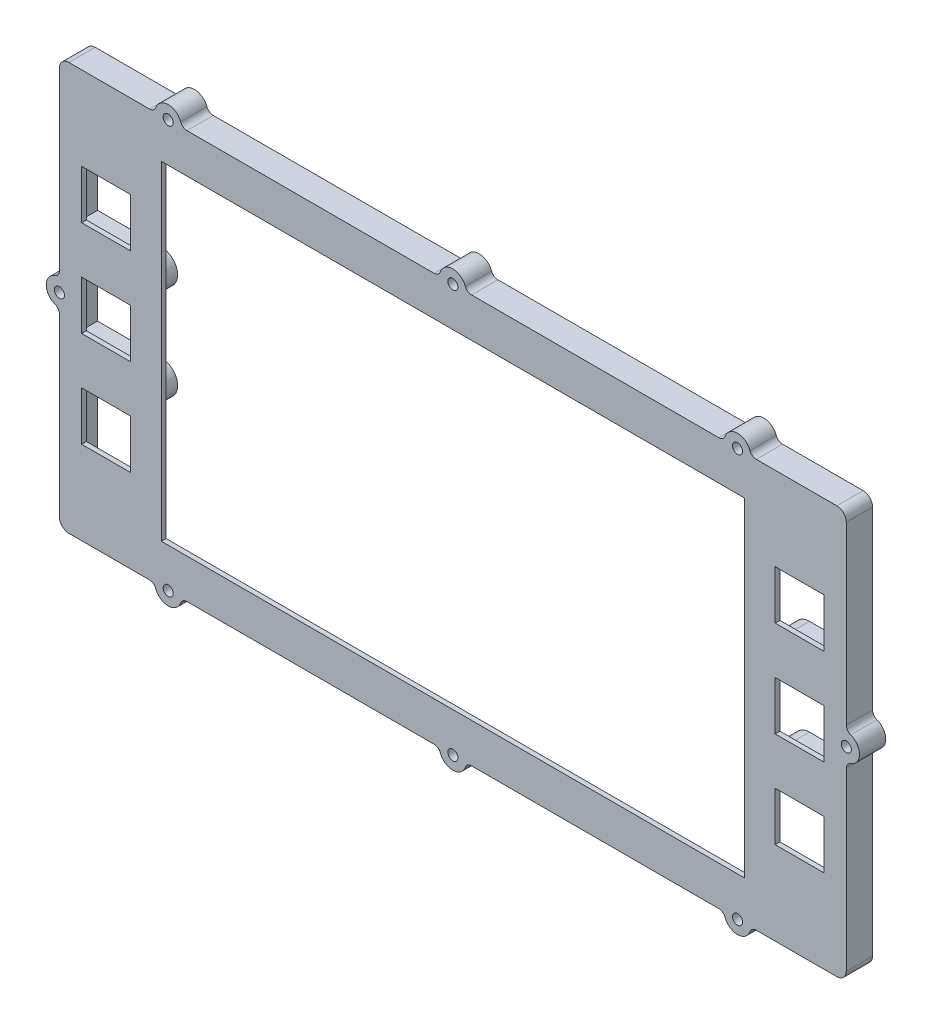
from build123d import *

# Parameters (mm, degrees)
SKETCH1_W           = 210.6422
SKETCH1_H           = 109.1692
BOSS_EXTRUDE1_DEPTH = 5.7658
SKETCH2_W           = 210.6422
SKETCH2_H           = 109.1692
SKETCH2_W_2         = 13.081
SKETCH2_H_2         = 13.081
SKETCH2_W_3         = 156.083
SKETCH2_H_3         = 88.0872
BOSS_EXTRUDE2_DEPTH = 1.27
CUT_EXTRUDE1_REACH  = 120.834
SKETCH3_R           = 1.3462
SKETCH3_3_R         = 1.3462
BOSS_EXTRUDE3_DEPTH = 7.0358
FILLET1_R           = 2.54
CUT_EXTRUDE2_REACH  = 122.497
SKETCH4_R           = 1.3462
SKETCH4_3_R         = 1.3462
BOSS_EXTRUDE4_DEPTH = 7.0358


with BuildPart() as part:
    # Sketch1 → Boss-Extrude1 (new body)
    with BuildSketch(Plane.XY):
        Rectangle(SKETCH1_W, SKETCH1_H)
        with BuildLine():
            Line((45.6565, 49.7078), (45.6565, 51.4096))
            Line((45.6565, 51.4096), (-42.2275, 51.4096))
            Line((-42.2275, 51.4096), (-42.2275, 49.7078))
            ThreePointArc((-42.2275, 49.7078), (-45.4025, 46.5328), (-48.5775, 49.7078))
            Line((-48.5775, 49.7078), (-48.5775, 51.4096))
            Line((-48.5775, 51.4096), (-73.9775, 51.4096))
            Line((-73.9775, 51.4096), (-73.9775, 49.7078))
            ThreePointArc((-73.9775, 49.7078), (-77.1525, 46.5328), (-80.3275, 49.7078))
            Line((-80.3275, 49.7078), (-80.3275, 51.4096))
            Line((-80.3275, 51.4096), (-102.1461, 51.4096))
            Line((-102.1461, 51.4096), (-102.1461, 17.1069))
            Line((-102.1461, 17.1069), (-84.9757, 17.1069))
            ThreePointArc((-84.9757, 17.1069), (-80.7085, 12.8397), (-84.9757, 8.5725))
            Line((-84.9757, 8.5725), (-102.1461, 8.5725))
            Line((-102.1461, 8.5725), (-102.1461, -8.5725))
            Line((-102.1461, -8.5725), (-84.9757, -8.5725))
            ThreePointArc((-84.9757, -8.5725), (-80.7085, -12.8397), (-84.9757, -17.1069))
            Line((-84.9757, -17.1069), (-102.1461, -17.1069))
            Line((-102.1461, -17.1069), (-102.1461, -51.4096))
            Line((-102.1461, -51.4096), (-78.509915544, -51.4096))
            ThreePointArc((-78.509915544, -51.4096), (-77.1525, -51.1048), (-75.795084456, -51.4096))
            Line((-75.795084456, -51.4096), (-46.759915544, -51.4096))
            ThreePointArc((-46.759915544, -51.4096), (-45.4025, -51.1048), (-44.045084456, -51.4096))
            Line((-44.045084456, -51.4096), (47.474084456, -51.4096))
            ThreePointArc((47.474084456, -51.4096), (48.8315, -51.1048), (50.188915544, -51.4096))
            Line((50.188915544, -51.4096), (79.224084456, -51.4096))
            ThreePointArc((79.224084456, -51.4096), (80.5815, -51.1048), (81.938915544, -51.4096))
            Line((81.938915544, -51.4096), (102.1461, -51.4096))
            Line((102.1461, -51.4096), (102.1461, -17.1069))
            Line((102.1461, -17.1069), (88.4047, -17.1069))
            ThreePointArc((88.4047, -17.1069), (84.1375, -12.8397), (88.4047, -8.5725))
            Line((88.4047, -8.5725), (102.1461, -8.5725))
            Line((102.1461, -8.5725), (102.1461, 8.5725))
            Line((102.1461, 8.5725), (88.4047, 8.5725))
            ThreePointArc((88.4047, 8.5725), (84.1375, 12.8397), (88.4047, 17.1069))
            Line((88.4047, 17.1069), (102.1461, 17.1069))
            Line((102.1461, 17.1069), (102.1461, 51.4096))
            Line((102.1461, 51.4096), (83.7565, 51.4096))
            Line((83.7565, 51.4096), (83.7565, 49.7078))
            ThreePointArc((83.7565, 49.7078), (80.5815, 46.5328), (77.4065, 49.7078))
            Line((77.4065, 49.7078), (77.4065, 51.4096))
            Line((77.4065, 51.4096), (52.0065, 51.4096))
            Line((52.0065, 51.4096), (52.0065, 49.7078))
            ThreePointArc((52.0065, 49.7078), (48.8315, 46.5328), (45.6565, 49.7078))
        make_face(mode=Mode.SUBTRACT)
    extrude(amount=BOSS_EXTRUDE1_DEPTH)

    # Sketch2 → Boss-Extrude2 (add)
    with BuildSketch(Plane.XY.offset(5.7658)):
        Rectangle(SKETCH2_W, SKETCH2_H)
        with Locations((92.8243, 25.6794)):
            Rectangle(SKETCH2_W_2, SKETCH2_H_2, mode=Mode.SUBTRACT)
        with Locations((92.8243, 0)):
            Rectangle(SKETCH2_W_2, SKETCH2_H_2, mode=Mode.SUBTRACT)
        with Locations((92.8243, -25.6794)):
            Rectangle(SKETCH2_W_2, SKETCH2_H_2, mode=Mode.SUBTRACT)
        with Locations((-92.8243, -25.6794)):
            Rectangle(SKETCH2_W_2, SKETCH2_H_2, mode=Mode.SUBTRACT)
        Rectangle(SKETCH2_W_3, SKETCH2_H_3, mode=Mode.SUBTRACT)
        with Locations((-92.8243, 0)):
            Rectangle(SKETCH2_W_2, SKETCH2_H_2, mode=Mode.SUBTRACT)
        with Locations((-92.8243, 25.6794)):
            Rectangle(SKETCH2_W_2, SKETCH2_H_2, mode=Mode.SUBTRACT)
    extrude(amount=BOSS_EXTRUDE2_DEPTH)

    # Sketch3 → Cut-Extrude1 (cut, up to next)
    with BuildSketch(Plane.XY, mode=Mode.PRIVATE) as cut_extrude1_sk1:
        with Locations((0, 54.5846)):
            Circle(SKETCH3_R)
    cut_extrude1_tool1 = extrude(cut_extrude1_sk1.sketch, amount=CUT_EXTRUDE1_REACH, mode=Mode.PRIVATE) & part.part
    # Sketch3 → Cut-Extrude1 (cut, up to next)
    with BuildSketch(Plane.XY, mode=Mode.PRIVATE) as cut_extrude1_sk2:
        with Locations((76.2, 54.5846)):
            Circle(SKETCH3_R)
    cut_extrude1_tool2 = extrude(cut_extrude1_sk2.sketch, amount=CUT_EXTRUDE1_REACH, mode=Mode.PRIVATE) & part.part
    # Sketch3 → Cut-Extrude1 (cut, up to next)
    with BuildSketch(Plane.XY, mode=Mode.PRIVATE) as cut_extrude1_sk3:
        with Locations((-76.2, 54.5846)):
            Circle(SKETCH3_R)
    cut_extrude1_tool3 = extrude(cut_extrude1_sk3.sketch, amount=CUT_EXTRUDE1_REACH, mode=Mode.PRIVATE) & part.part
    cut_extrude1_1 = cut_extrude1_tool1.solids().sort_by_distance((0, 54.5846, 0))[0]
    add(cut_extrude1_1, mode=Mode.SUBTRACT)
    cut_extrude1_2 = cut_extrude1_tool2.solids().sort_by_distance((76.2, 54.5846, 0))[0]
    add(cut_extrude1_2, mode=Mode.SUBTRACT)
    cut_extrude1_3 = cut_extrude1_tool3.solids().sort_by_distance((-76.2, 54.5846, 0))[0]
    add(cut_extrude1_3, mode=Mode.SUBTRACT)
    cut_extrude1 = cut_extrude1_1 + cut_extrude1_2 + cut_extrude1_3  # Cut-Extrude1 as one shape, for the pattern or mirror that repeats it

    # Sketch3<3> → Boss-Extrude3 (add)
    # profile 1 of 3: a face of its own
    with BuildSketch(Plane.XY):
        with BuildLine():
            Line((5.001994598, 54.5846), (5.001994598, 52.2986))
            Line((5.001994598, 52.2986), (-5.001994598, 52.2986))
            Line((-5.001994598, 52.2986), (-5.001994598, 54.5846))
            ThreePointArc((-5.001994598, 54.5846), (-3.97669446, 54.910001078), (-3.326685403, 55.767097608))
            ThreePointArc((-3.326685403, 55.767097608), (0, 58.1152), (3.326685403, 55.767097608))
            ThreePointArc((3.326685403, 55.767097608), (3.97669446, 54.910001078), (5.001994598, 54.5846))
        make_face()
        with Locations(Location((0, 54.5846, 0), (0, 0, 180))):
            Circle(SKETCH3_3_R, mode=Mode.SUBTRACT)
    # profile 2 of 3: a face of its own
    with BuildSketch(Plane.XY):
        with BuildLine():
            Line((-81.201994598, 54.5846), (-81.201994598, 52.2986))
            Line((-81.201994598, 52.2986), (-71.198005402, 52.2986))
            Line((-71.198005402, 52.2986), (-71.198005402, 54.5846))
            ThreePointArc((-71.198005402, 54.5846), (-72.22330554, 54.910001078), (-72.873314597, 55.767097608))
            ThreePointArc((-72.873314597, 55.767097608), (-76.2, 58.1152), (-79.526685403, 55.767097608))
            ThreePointArc((-79.526685403, 55.767097608), (-80.17669446, 54.910001078), (-81.201994598, 54.5846))
        make_face()
        with Locations(Location((-76.2, 54.5846, 0), (0, 0, 180))):
            Circle(SKETCH3_3_R, mode=Mode.SUBTRACT)
    # profile 3 of 3: a face of its own
    with BuildSketch(Plane.XY):
        with BuildLine():
            Line((71.198005402, 54.5846), (71.198005402, 52.2986))
            Line((71.198005402, 52.2986), (81.201994598, 52.2986))
            Line((81.201994598, 52.2986), (81.201994598, 54.5846))
            ThreePointArc((81.201994598, 54.5846), (80.17669446, 54.910001078), (79.526685403, 55.767097608))
            ThreePointArc((79.526685403, 55.767097608), (76.2, 58.1152), (72.873314597, 55.767097608))
            ThreePointArc((72.873314597, 55.767097608), (72.22330554, 54.910001078), (71.198005402, 54.5846))
        make_face()
        with Locations(Location((76.2, 54.5846, 0), (0, 0, 180))):
            Circle(SKETCH3_3_R, mode=Mode.SUBTRACT)
    boss_extrude3 = extrude(amount=BOSS_EXTRUDE3_DEPTH)

    # Mirror1: Cut-Extrude1, Boss-Extrude3 across plane
    add(cut_extrude1.mirror(Plane.ZX), mode=Mode.SUBTRACT)
    add(boss_extrude3.mirror(Plane.ZX))

    # Fillet1
    fillet1_edges = [part.edges().sort_by_distance(p)[0] for p in [
        (-105.3211, 54.5846, 3.5179),
        (105.3211, 54.5846, 3.5179),
        (105.3211, -54.5846, 3.5179),
        (-105.3211, -54.5846, 3.5179),
    ]]
    fillet(fillet1_edges, radius=FILLET1_R)

    # Sketch4 → Cut-Extrude2 (cut, up to next)
    with BuildSketch(Plane.XY, mode=Mode.PRIVATE) as cut_extrude2_sk1:
        with Locations((105.3211, 0)):
            Circle(SKETCH4_R)
    cut_extrude2_tool1 = extrude(cut_extrude2_sk1.sketch, amount=CUT_EXTRUDE2_REACH, mode=Mode.PRIVATE) & part.part
    cut_extrude2 = cut_extrude2_tool1.solids().sort_by_distance((105.3211, 0, 0))[0]
    add(cut_extrude2, mode=Mode.SUBTRACT)

    # Sketch4<3> → Boss-Extrude4 (add)
    with BuildSketch(Plane.XY):
        with BuildLine():
            Line((105.3211, -5.001994598), (103.0351, -5.001994598))
            Line((103.0351, -5.001994598), (103.0351, 5.001994598))
            Line((103.0351, 5.001994598), (105.3211, 5.001994598))
            ThreePointArc((105.3211, 5.001994598), (105.646501078, 3.97669446), (106.503597608, 3.326685403))
            ThreePointArc((106.503597608, 3.326685403), (108.8517, 0), (106.503597608, -3.326685403))
            ThreePointArc((106.503597608, -3.326685403), (105.646501078, -3.97669446), (105.3211, -5.001994598))
        make_face()
        with Locations(Location((105.3211, 0, 0), (0, 0, 180))):
            Circle(SKETCH4_3_R, mode=Mode.SUBTRACT)
    boss_extrude4 = extrude(amount=BOSS_EXTRUDE4_DEPTH)

    # Mirror2: Cut-Extrude2, Boss-Extrude4 across plane
    add(cut_extrude2.mirror(Plane(origin=(0, 0, 0), x_dir=(0, 0, 1), z_dir=(1, 0, 0))), mode=Mode.SUBTRACT)
    add(boss_extrude4.mirror(Plane(origin=(0, 0, 0), x_dir=(0, 0, 1), z_dir=(1, 0, 0))))


solid = part.part
